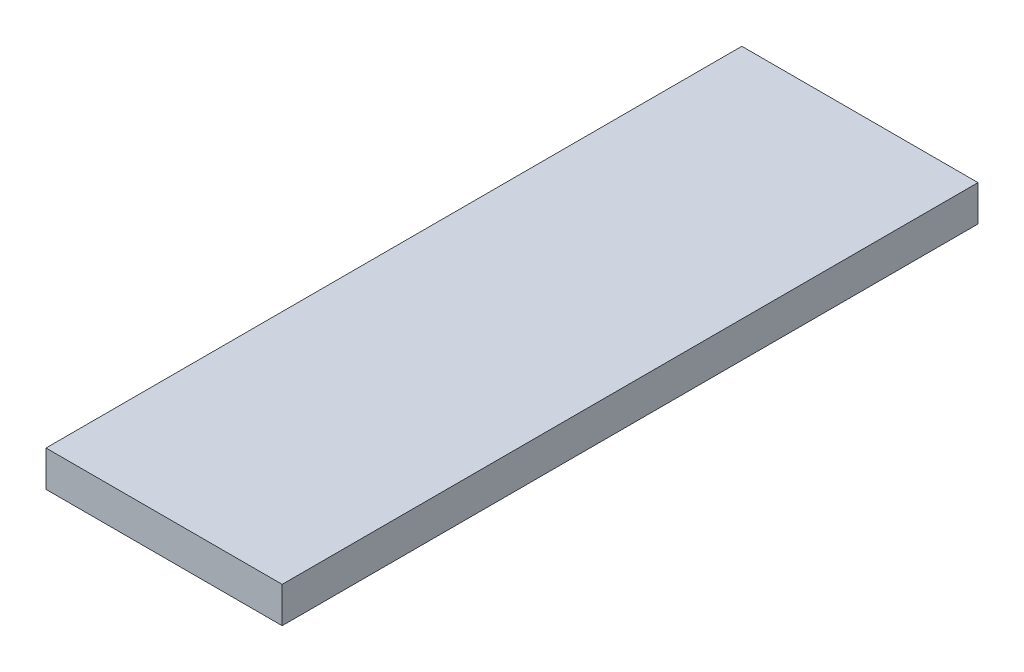
from build123d import *

# Parameters (mm, degrees)
SKETCH1_W           = 56
SKETCH1_H           = 165
BOSS_EXTRUDE1_DEPTH = 4.25


with BuildPart() as part:
    # Sketch1 → Boss-Extrude1 (new, symmetric)
    with BuildSketch(Plane(origin=(0, 0, 0), x_dir=(1, 0, 0), z_dir=(0, 1, 0))):
        Rectangle(SKETCH1_W, SKETCH1_H)
    extrude(amount=BOSS_EXTRUDE1_DEPTH, both=True)


solid = part.part
